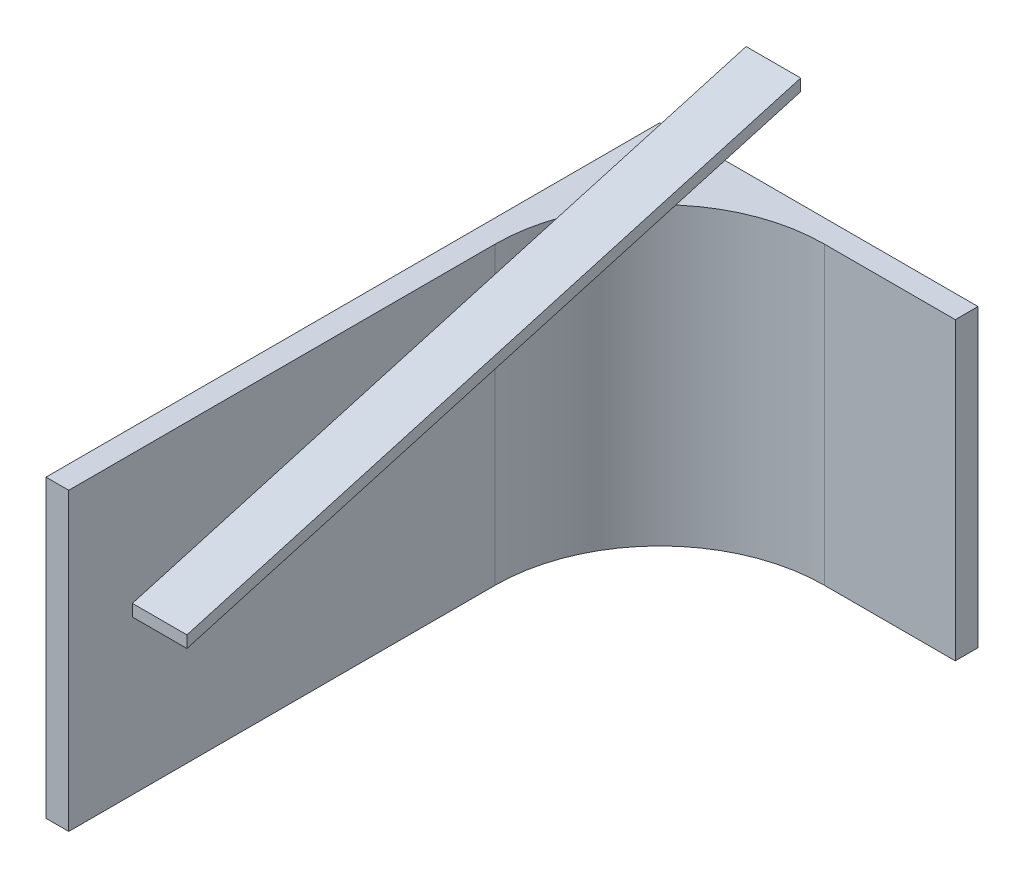
from build123d import *

# Parameters (mm, degrees)
BOSS_EXTRUDE1_DEPTH = 65
BOSS_EXTRUDE3_START = -19
BOSS_EXTRUDE3_DEPTH = 12


with BuildPart() as part:
    # Sketch1 → Boss-Extrude1 (new body)
    with BuildSketch(Plane(origin=(0, 0, 0), x_dir=(1, 0, 0), z_dir=(0, 1, 0))):
        Polygon((0, 70), (0, 65), (-65, 65), (-65, -65), (-70, -65), (-70, 70), align=None)
        with BuildLine():
            ThreePointArc((-65, 28.786796564), (-54.393398282, 54.393398282), (-28.786796564, 65))
            Line((-28.786796564, 65), (-65, 65))
            Line((-65, 65), (-65, 28.786796564))
        make_face()
    extrude(amount=-BOSS_EXTRUDE1_DEPTH)


with BuildPart() as body_2:
    # Sketch3 → Boss-Extrude3 (new body)
    with BuildSketch(Plane.ZY.offset(70).offset(BOSS_EXTRUDE3_START)):
        Polygon((-70, 21.428571429), (65, -17.142857143), (65, -14.542817897), (-70, 24.028610675), align=None)
    extrude(amount=-BOSS_EXTRUDE3_DEPTH)


solid = Compound([part.part, body_2.part])
